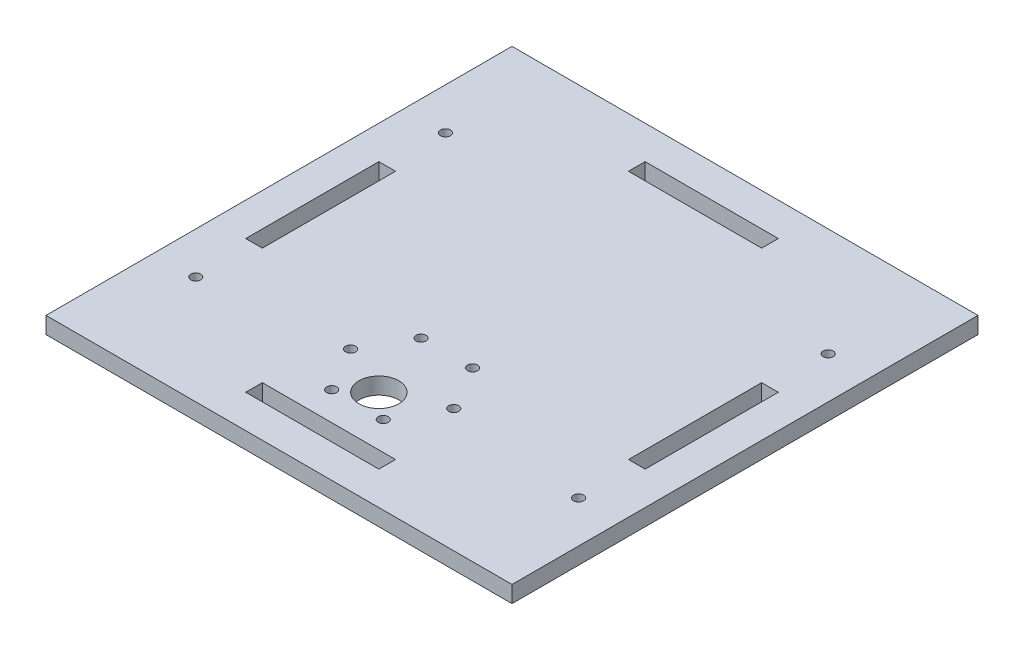
from build123d import *

# Parameters (mm, degrees)
CROQUIS2_W              = 140
CROQUIS2_H              = 140
CROQUIS2_R              = 1.5
CROQUIS2_R_2            = 6
CROQUIS2_W_2            = 40
CROQUIS2_H_2            = 5
CROQUIS2_W_3            = 5
CROQUIS2_H_3            = 40
SALIENTE_EXTRUIR1_DEPTH = 5


with BuildPart() as part:
    # Croquis2 → Saliente-Extruir1 (new body)
    with BuildSketch(Plane(origin=(0, 0, 0), x_dir=(1, 0, 0), z_dir=(0, 1, 0))):
        with Locations((70, 70)):
            Rectangle(CROQUIS2_W, CROQUIS2_H)
        with Locations(Location((12.5, 107.5, 0), (0, 0, 270))):
            Circle(CROQUIS2_R, mode=Mode.SUBTRACT)
        with Locations(Location((12.5, 32.5, 0), (0, 0, 90))):
            Circle(CROQUIS2_R, mode=Mode.SUBTRACT)
        with Locations(Location((127.5, 32.5, 0), (0, 0, 270))):
            Circle(CROQUIS2_R, mode=Mode.SUBTRACT)
        with Locations(Location((127.5, 107.5, 0), (0, 0, 90))):
            Circle(CROQUIS2_R, mode=Mode.SUBTRACT)
        with Locations(Location((85.5, 37, 0), (0, 0, 270))):
            Circle(CROQUIS2_R, mode=Mode.SUBTRACT)
        with Locations(Location((77.75, 23.576606241, 0), (0, 0, 270))):
            Circle(CROQUIS2_R, mode=Mode.SUBTRACT)
        with Locations(Location((62.25, 23.576606241, 0), (0, 0, 270))):
            Circle(CROQUIS2_R, mode=Mode.SUBTRACT)
        with Locations(Location((54.5, 37, 0), (0, 0, 270))):
            Circle(CROQUIS2_R, mode=Mode.SUBTRACT)
        with Locations(Location((62.25, 50.423393759, 0), (0, 0, 270))):
            Circle(CROQUIS2_R, mode=Mode.SUBTRACT)
        with Locations(Location((77.75, 50.423393759, 0), (0, 0, 270))):
            Circle(CROQUIS2_R, mode=Mode.SUBTRACT)
        with Locations(Location((70, 30, 0), (0, 0, 270))):
            Circle(CROQUIS2_R_2, mode=Mode.SUBTRACT)
        with Locations((70, 127.5)):
            Rectangle(CROQUIS2_W_2, CROQUIS2_H_2, mode=Mode.SUBTRACT)
        with Locations((70, 12.5)):
            Rectangle(CROQUIS2_W_2, CROQUIS2_H_2, mode=Mode.SUBTRACT)
        with Locations((127.5, 70)):
            Rectangle(CROQUIS2_W_3, CROQUIS2_H_3, mode=Mode.SUBTRACT)
        with Locations((12.5, 70)):
            Rectangle(CROQUIS2_W_3, CROQUIS2_H_3, mode=Mode.SUBTRACT)
    extrude(amount=SALIENTE_EXTRUIR1_DEPTH)


solid = part.part
